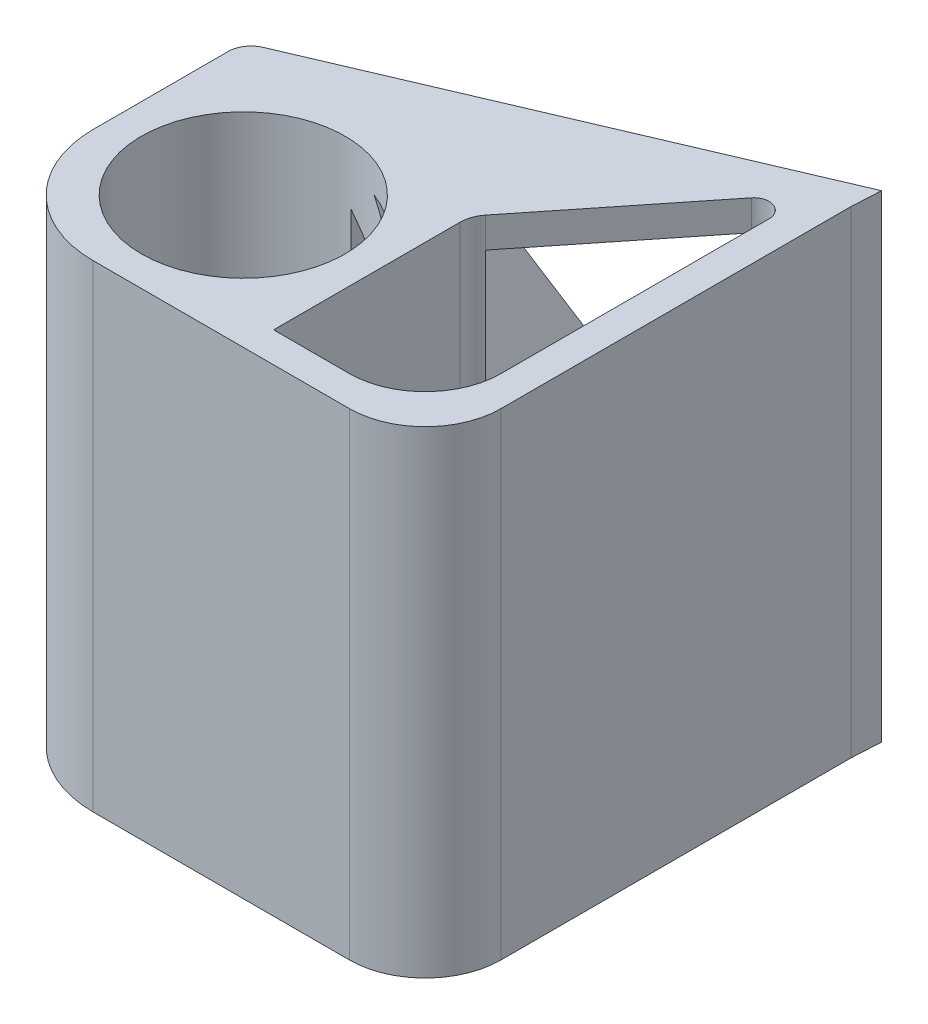
from build123d import *

# Parameters (mm, degrees)
BOSS_EXTRUDE1_DEPTH            = 59
BOSS_EXTRUDE1_DEPTH_BACK       = 4
SKETCH2_R                      = 13.45
FILLET1_R                      = 15
FILLET2_R                      = 3
CUT_EXTRUDE1_REACH             = 88.686
CUT_EXTRUDE1_DIRECTION_2_DEPTH = 87.685720739
SKETCH4_R                      = 1.4
CUT_EXTRUDE2_DEPTH             = 9


with BuildPart() as part:
    # Sketch2 → Boss-Extrude1 (new, two sides: drawn at the far end of the back side and taken through both)
    with BuildSketch(Plane(origin=(0, 0, 0), x_dir=(1, 0, 0), z_dir=(0, 1, 0)).offset(-BOSS_EXTRUDE1_DEPTH_BACK)):
        with BuildLine():
            Line((-17.4, -17.4), (17.4, -17.4))
            Line((17.4, -17.4), (31.4, -17.4))
            ThreePointArc((31.4, -17.4), (38.471067812, -14.471067812), (41.4, -7.4))
            Line((41.4, -7.4), (41.4, 38.781202895))
            Line((41.4, 38.781202895), (41.615303514, 42.605074323))
            Line((41.615303514, 42.605074323), (-17.4, 17.4))
            Line((-17.4, 17.4), (-17.4, -17.4))
        make_face()
        with Locations(Location((0, 0, 0), (0, 0, 270))):
            Circle(SKETCH2_R, mode=Mode.SUBTRACT)
        with BuildLine():
            Line((17.4, -13.4), (17.4, 11.200201908))
            ThreePointArc((17.4, 11.200201908), (17.624507156, 12.521433828), (18.272826893, 13.694352737))
            Line((18.272826893, 13.694352737), (33.836413447, 33.208019968))
            ThreePointArc((33.836413447, 33.208019968), (36.06061596, 33.848690975), (37.4, 31.960944553))
            Line((37.4, 31.960944553), (37.4, -3.4))
            ThreePointArc((37.4, -3.4), (34.471067812, -10.471067812), (27.4, -13.4))
            Line((27.4, -13.4), (17.4, -13.4))
        make_face(mode=Mode.SUBTRACT)
    extrude(amount=BOSS_EXTRUDE1_DEPTH + BOSS_EXTRUDE1_DEPTH_BACK)

    # Fillet1
    fillet1_edges = [part.edges().sort_by_distance(p)[0] for p in [
        (-17.4, 27.5, 17.4),
    ]]
    fillet(fillet1_edges, radius=FILLET1_R)

    # Fillet2
    fillet2_edges = [part.edges().sort_by_distance(p)[0] for p in [
        (-17.4, 27.5, -17.4),
    ]]
    fillet(fillet2_edges, radius=FILLET2_R)

    # Cut-Extrude1: up to this plane
    cut_extrude1_end = Plane(origin=(18.272826893, -4, -13.694352737), z_dir=(-0.7817932766673829, 0, -0.6235377074064384))
    # Sketch3 → Cut-Extrude1 (cut, up to the surface)
    with BuildSketch(Plane(origin=(-8.969274917, 0, -21.000710996), x_dir=(-0.9196362986724037, 0, 0.39277102510765927), z_dir=(-0.39277102510765927, 0, -0.9196362986724037)), mode=Mode.PRIVATE) as cut_extrude1_sk1:
        Polygon((-47.774830044, 0), (-9.235134773, 0), (-28.504982408, 23.552035999), align=None)
    cut_extrude1_tool1 = split(extrude(cut_extrude1_sk1.sketch, amount=-CUT_EXTRUDE1_REACH, mode=Mode.PRIVATE), bisect_by=cut_extrude1_end, keep=Keep.BOTH, mode=Mode.PRIVATE)
    add(cut_extrude1_tool1.solids().sort_by_distance((17.244942, 7.850679, -32.196642))[0], mode=Mode.SUBTRACT)
    # Sketch3 → Cut-Extrude1 (cut, up to the surface)
    with BuildSketch(Plane(origin=(-8.969274917, 0, -21.000710996), x_dir=(-0.9196362986724037, 0, 0.39277102510765927), z_dir=(-0.39277102510765927, 0, -0.9196362986724037)), mode=Mode.PRIVATE) as cut_extrude1_sk2:
        Polygon((-51.004982408, 3.947964001), (-51.004982408, 51.052035999), (-31.735134773, 27.5), align=None)
    cut_extrude1_tool2 = split(extrude(cut_extrude1_sk2.sketch, amount=-CUT_EXTRUDE1_REACH, mode=Mode.PRIVATE), bisect_by=cut_extrude1_end, keep=Keep.BOTH, mode=Mode.PRIVATE)
    add(cut_extrude1_tool2.solids().sort_by_distance((32.029675, 27.5, -38.511111))[0], mode=Mode.SUBTRACT)
    # Sketch3 → Cut-Extrude1 (cut, up to the surface)
    with BuildSketch(Plane(origin=(-8.969274917, 0, -21.000710996), x_dir=(-0.9196362986724037, 0, 0.39277102510765927), z_dir=(-0.39277102510765927, 0, -0.9196362986724037)), mode=Mode.PRIVATE) as cut_extrude1_sk3:
        Polygon((-47.774830044, 55), (-9.235134773, 55), (-28.504982408, 31.447964001), align=None)
    cut_extrude1_tool3 = split(extrude(cut_extrude1_sk3.sketch, amount=-CUT_EXTRUDE1_REACH, mode=Mode.PRIVATE), bisect_by=cut_extrude1_end, keep=Keep.BOTH, mode=Mode.PRIVATE)
    add(cut_extrude1_tool3.solids().sort_by_distance((17.244942, 47.149321, -32.196642))[0], mode=Mode.SUBTRACT)
    # Sketch3 → Cut-Extrude1 (cut, up to the surface)
    with BuildSketch(Plane(origin=(-8.969274917, 0, -21.000710996), x_dir=(-0.9196362986724037, 0, 0.39277102510765927), z_dir=(-0.39277102510765927, 0, -0.9196362986724037)), mode=Mode.PRIVATE) as cut_extrude1_sk4:
        Polygon((-6.004982408, 3.947964001), (-6.004982408, 51.052035999), (-25.274830044, 27.5), align=None)
    cut_extrude1_tool4 = split(extrude(cut_extrude1_sk4.sketch, amount=-CUT_EXTRUDE1_REACH, mode=Mode.PRIVATE), bisect_by=cut_extrude1_end, keep=Keep.BOTH, mode=Mode.PRIVATE)
    add(cut_extrude1_tool4.solids().sort_by_distance((2.460209, 27.5, -25.882173))[0], mode=Mode.SUBTRACT)

    # Sketch3 → Cut-Extrude1 direction 2 (cut)
    with BuildSketch(Plane(origin=(-8.969274917, 0, -21.000710996), x_dir=(-0.9196362986724037, 0, 0.39277102510765927), z_dir=(-0.39277102510765927, 0, -0.9196362986724037))):
        Polygon((-47.774830044, 0), (-9.235134773, 0), (-28.504982408, 23.552035999), align=None)
        Polygon((-51.004982408, 3.947964001), (-51.004982408, 51.052035999), (-31.735134773, 27.5), align=None)
        Polygon((-47.774830044, 55), (-9.235134773, 55), (-28.504982408, 31.447964001), align=None)
        Polygon((-6.004982408, 3.947964001), (-6.004982408, 51.052035999), (-25.274830044, 27.5), align=None)
    extrude(amount=CUT_EXTRUDE1_DIRECTION_2_DEPTH, mode=Mode.SUBTRACT)

    # Sketch4 → Cut-Extrude2 (cut)
    with BuildSketch(Plane(origin=(-8.969274917, 0, -21.000710996), x_dir=(-0.9196362986724037, 0, 0.3927710251076594), z_dir=(-0.3927710251076594, 0, -0.9196362986724037))):
        with Locations((-49.389906226, 1.973982)):
            Circle(SKETCH4_R)
        with Locations((-7.620058591, 1.973982)):
            Circle(SKETCH4_R)
        with Locations((-7.620058591, 53.026018)):
            Circle(SKETCH4_R)
        with Locations((-49.389906226, 53.026018)):
            Circle(SKETCH4_R)
    extrude(amount=-CUT_EXTRUDE2_DEPTH, mode=Mode.SUBTRACT)


solid = part.part
